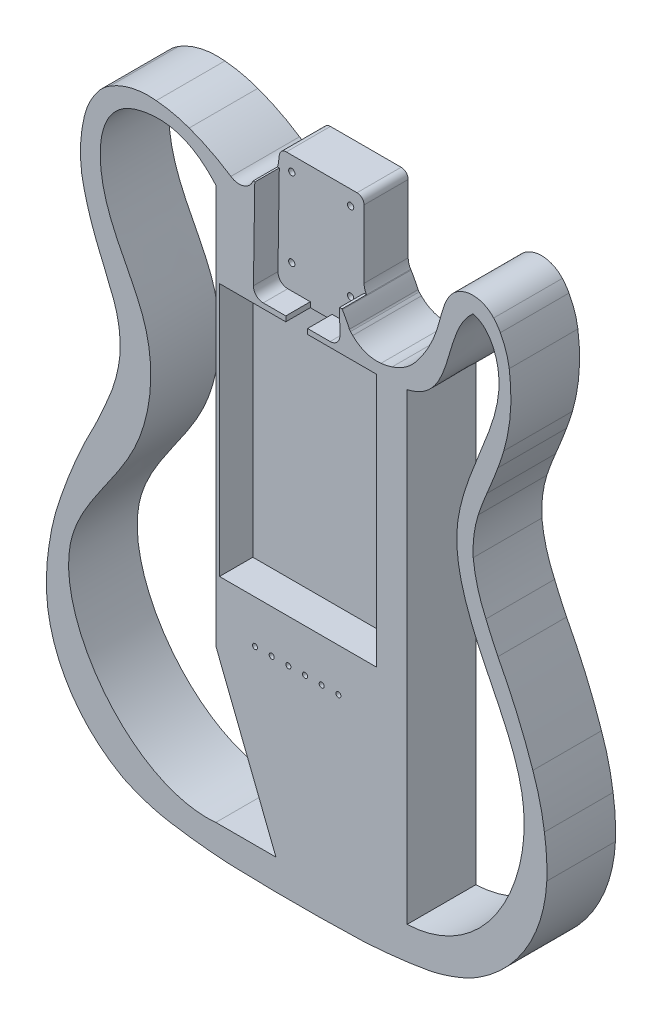
from build123d import *

# Parameters (mm, degrees)
EXTRUDE1_DEPTH     = 44.45
EXTRUDE2_START     = -15.875
EXTRUDE2_DEPTH     = 15.875
SKETCH4_R          = 2.032
EXTRUDE3_DEPTH     = 661.142024979
SKETCH5_W          = 14.1224
SKETCH5_H          = 11.557
EXTRUDE4_DEPTH     = 15.875
EXTRUDE5_DEPTH     = 17.4498
EXTRUDE6_DEPTH     = 21.59
EXTRUDE9_DEPTH     = 17.4498
SKETCH12_R         = 1.651
EXTRUDE10_DEPTH    = 662.019489136
SKETCH13_R         = 4.826
EXTRUDE11_DEPTH    = 1.4224
SKETCH14_R         = 4.064
EXTRUDE12_DEPTH    = 7.874
CUT_EXTRUDE1_REACH = 663.019
SKETCH15_W         = 101.6
SKETCH15_H         = 164.234062165
CUT_EXTRUDE2_DEPTH = 127
CUT_EXTRUDE3_DEPTH = 127
CUT_EXTRUDE4_DEPTH = 76.2


with BuildPart() as part:
    # Sketch2 → Extrude1 (new body)
    with BuildSketch(Plane.XY):
        with BuildLine():
            Line((236.701314765, -109.52926958), (237.322551245, -104.518285004))
            ThreePointArc((237.322551245, -104.518285004), (238.832324595, -101.654790046), (241.859816, -100.5087906))
            Line((241.859816, -100.5087906), (287.627187, -100.5087906))
            ThreePointArc((287.627187, -100.5087906), (290.860079204, -101.847898396), (292.199187, -105.0807906))
            Line((292.199187, -105.0807906), (292.199187, -149.0184218))
            ThreePointArc((292.199187, -149.0184218), (292.597958053, -151.927621282), (293.795193618, -154.608868562))
            ThreePointArc((293.795193618, -154.608868562), (293.913773723, -154.790051229), (294.036001367, -154.968793512))
            ThreePointArc((294.036001367, -154.968793512), (296.462850079, -159.222895043), (298.58610753, -163.636368995))
            ThreePointArc((298.58610753, -163.636368995), (298.881112709, -164.165143005), (299.271135507, -164.628297651))
            ThreePointArc((299.271135507, -164.628297651), (300.007264707, -165.356749106), (300.73644663, -166.092154739))
            ThreePointArc((300.73644663, -166.092154739), (309.134939866, -171.428010927), (319.025875401, -172.512189948))
            ThreePointArc((319.025875401, -172.512189948), (322.667874381, -171.899747758), (326.235195219, -170.94399463))
            ThreePointArc((326.235195219, -170.94399463), (334.736991182, -166.788776714), (341.69241097, -160.372507853))
            ThreePointArc((341.69241097, -160.372507853), (350.978860141, -145.938116384), (356.931481894, -129.839790708))
            ThreePointArc((356.931481894, -129.839790708), (358.444492908, -124.360678247), (360.217684146, -118.960153409))
            ThreePointArc((360.217684146, -118.960153409), (361.726955491, -115.496522091), (363.691265694, -112.269119525))
            ThreePointArc((363.691265694, -112.269119525), (377.452236791, -104.634981944), (392.000789341, -110.63364853))
            ThreePointArc((392.000789341, -110.63364853), (394.334174265, -113.548333419), (396.320318679, -116.709868421))
            ThreePointArc((396.320318679, -116.709868421), (399.985801408, -125.076496738), (402.069054575, -133.970106202))
            ThreePointArc((402.069054575, -133.970106202), (402.850473596, -158.142444635), (398.510836922, -181.934882814))
            ThreePointArc((398.510836922, -181.934882814), (396.712752953, -187.660630305), (394.711731045, -193.318651304))
            ThreePointArc((394.711731045, -193.318651304), (391.254221541, -202.284530505), (387.604313736, -211.173823775))
            ThreePointArc((387.604313736, -211.173823775), (384.645418623, -218.559200445), (381.97307243, -226.053025547))
            ThreePointArc((381.97307243, -226.053025547), (379.220115758, -238.701804496), (378.745605361, -251.638002516))
            ThreePointArc((378.745605361, -251.638002516), (381.624241727, -267.094911335), (387.005590994, -281.867983379))
            ThreePointArc((387.005590994, -281.867983379), (390.741696955, -290.562895178), (394.746018404, -299.137589848))
            ThreePointArc((394.746018404, -299.137589848), (407.105387056, -324.908404556), (417.355590006, -351.588401252))
            ThreePointArc((417.355590006, -351.588401252), (421.906718125, -366.822834456), (424.846419648, -382.448418515))
            ThreePointArc((424.846419648, -382.448418515), (426.249850723, -395.79034395), (426.367663828, -409.205362144))
            ThreePointArc((426.367663828, -409.205362144), (413.851256788, -452.11341389), (383.140740026, -484.58841212))
            ThreePointArc((383.140740026, -484.58841212), (376.726903694, -488.327090669), (369.979691238, -491.423885444))
            ThreePointArc((369.979691238, -491.423885444), (361.755548517, -494.399048058), (353.346112162, -496.801025635))
            ThreePointArc((353.346112162, -496.801025635), (351.598275163, -497.203126282), (349.837333504, -497.543278577))
            ThreePointArc((349.837333504, -497.543278577), (328.927692137, -500.563756073), (307.875617353, -502.337603226))
            ThreePointArc((307.875617353, -502.337603226), (264.647049723, -503.080365686), (221.41824861, -502.351318606))
            ThreePointArc((221.41824861, -502.351318606), (221.00580821, -502.335100706), (220.593567708, -502.314415619))
            ThreePointArc((220.593567708, -502.314415619), (201.284363819, -500.712124888), (182.091052494, -498.06080619))
            ThreePointArc((182.091052494, -498.06080619), (175.416754512, -496.721648206), (168.847112314, -494.938561263))
            ThreePointArc((168.847112314, -494.938561263), (162.119330737, -492.66041844), (155.529409804, -490.009772905))
            ThreePointArc((155.529409804, -490.009772905), (153.132812394, -488.891967619), (150.797631292, -487.650961163))
            ThreePointArc((150.797631292, -487.650961163), (116.491995751, -454.558228352), (102.514776867, -408.988030339))
            ThreePointArc((102.514776867, -408.988030339), (102.647448667, -395.681700976), (104.046018753, -382.448409448))
            ThreePointArc((104.046018753, -382.448409448), (106.98510575, -366.822864688), (111.535598588, -351.588400588))
            ThreePointArc((111.535598588, -351.588400588), (121.785921274, -324.908172846), (134.146411655, -299.137609307))
            ThreePointArc((134.146411655, -299.137609307), (138.150111982, -290.562902597), (141.885599861, -281.867999389))
            ThreePointArc((141.885599861, -281.867999389), (147.267652973, -267.095112393), (150.145582523, -251.638003757))
            ThreePointArc((150.145582523, -251.638003757), (148.821670426, -233.475790137), (143.036402463, -216.208786303))
            ThreePointArc((143.036402463, -216.208786303), (140.009349985, -208.5521602), (136.805998568, -200.967602883))
            ThreePointArc((136.805998568, -200.967602883), (133.075014503, -191.465363775), (129.82521382, -181.787988837))
            ThreePointArc((129.82521382, -181.787988837), (127.242537041, -172.460798588), (125.255618654, -162.988794966))
            ThreePointArc((125.255618654, -162.988794966), (124.573431659, -146.269657735), (127.035980496, -129.718803313))
            ThreePointArc((127.035980496, -129.718803313), (131.043720455, -119.123881134), (137.44559748, -109.77881152))
            ThreePointArc((137.44559748, -109.77881152), (140.408836969, -107.058482812), (143.665986338, -104.697984023))
            ThreePointArc((143.665986338, -104.697984023), (158.033642326, -98.861944673), (173.515606109, -97.968809036))
            ThreePointArc((173.515606109, -97.968809036), (184.337065562, -99.609972723), (194.84638863, -102.668000127))
            ThreePointArc((194.84638863, -102.668000127), (208.754429598, -108.681110615), (221.847962027, -116.306758775))
            ThreePointArc((221.847962027, -116.306758775), (231.168773326, -117.069146469), (236.701314765, -109.52926958))
        make_face()
    extrude(amount=EXTRUDE1_DEPTH)

    # Sketch3 → Extrude2 (cut)
    with BuildSketch(Plane.XY.offset(44.45).offset(EXTRUDE2_START)):
        with BuildLine():
            Line((292.208331, -154.6088094), (293.795193618, -154.608868562))
            ThreePointArc((293.795193618, -154.608868562), (292.597958053, -151.927621282), (292.199187, -149.0184218))
            Line((292.199187, -149.0184218), (292.199187, -105.0807906))
            ThreePointArc((292.199187, -105.0807906), (290.860079204, -101.847898396), (287.627187, -100.5087906))
            Line((287.627187, -100.5087906), (241.859816, -100.5087906))
            ThreePointArc((241.859816, -100.5087906), (238.832324595, -101.654790046), (237.322551245, -104.518285004))
            Line((237.322551245, -104.518285004), (236.701314765, -109.52926958))
            ThreePointArc((236.701314765, -109.52926958), (236.495331634, -110.644913986), (236.1589638, -111.7284024))
            Line((236.1589638, -111.7284024), (237.3235792, -111.7284024))
            Line((237.3235792, -111.7284024), (236.4498446, -170.3148994))
            ThreePointArc((236.4498446, -170.3148994), (238.275654169, -174.866112687), (242.7991334, -176.7595906))
            Line((242.7991334, -176.7595906), (257.3850072, -176.7595906))
            Line((257.3850072, -176.7595906), (271.5074072, -176.7595906))
            Line((271.5074072, -176.7595906), (286.0932556, -176.7595906))
            ThreePointArc((286.0932556, -176.7595906), (290.616738468, -174.866114216), (292.44254953, -170.31489855))
            Line((292.44254953, -170.31489855), (292.208331, -154.6088094))
        make_face()
    extrude(amount=EXTRUDE2_DEPTH, mode=Mode.SUBTRACT)

    # Sketch4 → Extrude3 (cut, through all)
    with BuildSketch(Plane.XY.offset(28.575)):
        with Locations((283.497782, -160.8336128)):
            Circle(SKETCH4_R)
        with Locations((245.397782, -160.8336128)):
            Circle(SKETCH4_R)
        with Locations((245.397782, -110.0336128)):
            Circle(SKETCH4_R)
        with Locations((283.497782, -110.0336128)):
            Circle(SKETCH4_R)
    extrude(amount=-EXTRUDE3_DEPTH, mode=Mode.SUBTRACT)

    # Sketch5 → Extrude4 (cut)
    with BuildSketch(Plane.XY.offset(44.45)):
        with Locations((264.4462072, -182.5380906)):
            Rectangle(SKETCH5_W, SKETCH5_H)
    extrude(amount=-EXTRUDE4_DEPTH, mode=Mode.SUBTRACT)

    # Sketch6 → Extrude5 (cut)
    with BuildSketch(Plane.XY.offset(44.45)):
        with BuildLine():
            Line((271.5074072, -188.3165906), (257.3850072, -188.3165906))
            Line((257.3850072, -188.3165906), (231.3870912, -188.3165906))
            ThreePointArc((231.3870912, -188.3165906), (223.137023148, -195.487932604), (229.089965361, -204.656042988))
            Line((229.089965361, -204.656042988), (254.492106786, -211.942516007))
            ThreePointArc((254.492106786, -211.942516007), (254.925516864, -212.034671401), (255.367536, -212.0655906))
            Line((255.367536, -212.0655906), (264.4462072, -212.0655906))
            Line((264.4462072, -212.0655906), (273.5248276, -212.0655906))
            ThreePointArc((273.5248276, -212.0655906), (273.966846297, -212.034671463), (274.400255962, -211.942516252))
            Line((274.400255962, -211.942516252), (299.802422661, -204.656043269))
            ThreePointArc((299.802422661, -204.656043269), (305.755365923, -195.487933108), (297.5052978, -188.3165906))
            Line((297.5052978, -188.3165906), (271.5074072, -188.3165906))
        make_face()
    extrude(amount=-EXTRUDE5_DEPTH, mode=Mode.SUBTRACT)

    # Sketch7 → Extrude6 (cut)
    with BuildSketch(Plane.XY.offset(44.45)):
        with BuildLine():
            Line((267.182014608, -293.873950251), (237.365174798, -296.644421471))
            ThreePointArc((237.365174798, -296.644421471), (229.219374538, -301.565359429), (228.0253758, -311.0069726))
            Line((228.0253758, -311.0069726), (233.0908216, -326.0407246))
            ThreePointArc((233.0908216, -326.0407246), (234.905674363, -328.839037735), (237.841094697, -330.422563679))
            Line((237.841094697, -330.422563679), (280.248995, -340.9960414))
            ThreePointArc((280.248995, -340.9960414), (283.58425184, -340.975976581), (286.500413487, -339.357229523))
            Line((286.500413487, -339.357229523), (298.0308492, -328.4612938))
            ThreePointArc((298.0308492, -328.4612938), (301.409166684, -319.564297135), (296.527090326, -311.395153414))
            Line((296.527090326, -311.395153414), (271.5010572, -294.9508198))
            ThreePointArc((271.5010572, -294.9508198), (269.433129751, -294.04502602), (267.182014608, -293.873950251))
        make_face()
    extrude(amount=-EXTRUDE6_DEPTH, mode=Mode.SUBTRACT)

    # Sketch11 → Extrude9 (cut)
    with BuildSketch(Plane.XY.offset(44.45)):
        with BuildLine():
            Line((311.5027552, -266.3978924), (268.936335809, -223.831463088))
            ThreePointArc((268.936335809, -223.831463088), (259.956079688, -223.831461991), (259.956078591, -232.811718112))
            Line((259.956078591, -232.811718112), (302.5224836, -275.3781386))
            ThreePointArc((302.5224836, -275.3781386), (307.012620383, -277.238017465), (311.502756589, -275.378137211))
            ThreePointArc((311.502756589, -275.378137211), (313.362621365, -270.888014517), (311.5027552, -266.3978924))
        make_face()
    extrude(amount=-EXTRUDE9_DEPTH, mode=Mode.SUBTRACT)

    # Sketch12 → Extrude10 (cut, through all)
    with BuildSketch(Plane.XY.offset(44.45)):
        with Locations((291.446204, -372.0851842)):
            Circle(SKETCH12_R)
        with Locations((280.6516104, -372.0851842)):
            Circle(SKETCH12_R)
        with Locations((269.8566104, -372.0851842)):
            Circle(SKETCH12_R)
        with Locations((259.0610008, -372.0851842)):
            Circle(SKETCH12_R)
        with Locations((248.2654166, -372.0851842)):
            Circle(SKETCH12_R)
        with Locations((237.4713818, -372.0851842)):
            Circle(SKETCH12_R)
    extrude(amount=-EXTRUDE10_DEPTH, mode=Mode.SUBTRACT)

    # Sketch13 → Extrude11 (cut)
    with BuildSketch(Plane(origin=(0, 0, 0), x_dir=(-1, 0, 0), z_dir=(0, 0, -1))):
        with Locations((-291.446204, -372.0851842)):
            Circle(SKETCH13_R)
        with Locations((-280.6516104, -372.0851842)):
            Circle(SKETCH13_R)
        with Locations((-269.8566104, -372.0851842)):
            Circle(SKETCH13_R)
        with Locations((-259.0610008, -372.0851842)):
            Circle(SKETCH13_R)
        with Locations((-248.2654166, -372.0851842)):
            Circle(SKETCH13_R)
        with Locations((-237.4713818, -372.0851842)):
            Circle(SKETCH13_R)
    extrude(amount=-EXTRUDE11_DEPTH, mode=Mode.SUBTRACT)

    # Sketch14 → Extrude12 (cut)
    with BuildSketch(Plane(origin=(0, 0, 0), x_dir=(-1, 0, 0), z_dir=(0, 0, -1))):
        with Locations((-291.446204, -372.0851842)):
            Circle(SKETCH14_R)
        with Locations((-280.6516104, -372.0851842)):
            Circle(SKETCH14_R)
        with Locations((-269.8566104, -372.0851842)):
            Circle(SKETCH14_R)
        with Locations((-259.0610008, -372.0851842)):
            Circle(SKETCH14_R)
        with Locations((-248.2654166, -372.0851842)):
            Circle(SKETCH14_R)
        with Locations((-237.4713818, -372.0851842)):
            Circle(SKETCH14_R)
    extrude(amount=-EXTRUDE12_DEPTH, mode=Mode.SUBTRACT)

    # Cut-Extrude1: up to this face of the body (flat: up to its plane)
    cut_extrude1_end = Plane(part.part.faces().sort_by_distance((263.793748235, -316.663316897, 22.86))[0])
    # Sketch15 → Cut-Extrude1 (cut, up to the picked face)
    with BuildSketch(Plane.XY.offset(44.45), mode=Mode.PRIVATE) as cut_extrude1_sk1:
        with Locations((265.2843056, -262.20414602)):
            Rectangle(SKETCH15_W, SKETCH15_H)
    cut_extrude1_tool1 = split(extrude(cut_extrude1_sk1.sketch, amount=-CUT_EXTRUDE1_REACH, mode=Mode.PRIVATE), bisect_by=cut_extrude1_end, keep=Keep.BOTH, mode=Mode.PRIVATE)
    add(cut_extrude1_tool1.solids().sort_by(Axis((265.284306, -262.204146, 44.45), (0, 0, -1)))[0], mode=Mode.SUBTRACT)

    # Sketch16 → Cut-Extrude2 (cut)
    with BuildSketch(Plane.XY.offset(44.45)):
        with BuildLine():
            Line((212.117694336, -126.053047777), (212.117694336, -483.398916887))
            add(Edge.make_bspline(
                [(159.770735068, -109.697476494), (135.695847539, -117.22364313), (132.536634655, -173.144528027), (175.573898591, -226.464399234), (166.83717468, -308.244385142), (79.954647743, -386.36584678), (159.442258277, -488.515057032), (212.117694336, -483.398916887)],
                knots=[0, 0, 0, 0, 0.149042994, 0.296708805, 0.45565069, 0.647251254, 1, 1, 1, 1], degree=3))
            add(Edge.make_bspline(
                [(159.770735068, -109.697476494), (189.910349197, -100.671756931), (212.117694336, -126.053047777)],
                knots=[0, 0, 0, 1, 1, 1], degree=2))
        make_face()
    extrude(amount=-CUT_EXTRUDE2_DEPTH, mode=Mode.SUBTRACT)

    # Sketch17 → Cut-Extrude3 (cut)
    with BuildSketch(Plane.XY.offset(44.45)):
        with BuildLine():
            Line((335.944612713, -178.791328569), (335.944612713, -478.667928848))
            add(Edge.make_bspline(
                [(378.597163477, -114.993083373), (386.103981492, -116.715709585), (401.941599585, -140.982772003), (384.733180917, -188.652966028), (361.840879188, -239.796113348), (381.022273443, -305.986134394), (435.316188683, -384.078546004), (386.634558396, -476.346923246), (335.944612713, -478.667928848)],
                knots=[0, 0, 0, 0, 0.053147341, 0.186283845, 0.336552989, 0.449657579, 0.663660518, 1, 1, 1, 1], degree=3))
            add(Edge.make_bspline(
                [(378.597163477, -114.993083373), (357.974783018, -133.1978322), (367.973021641, -171.509733696), (335.944612713, -178.791328569)],
                knots=[0, 0, 0, 0, 1, 1, 1, 1], degree=3))
        make_face()
    extrude(amount=-CUT_EXTRUDE3_DEPTH, mode=Mode.SUBTRACT)

    # Sketch18 → Cut-Extrude4 (cut)
    with BuildSketch(Plane.XY.offset(44.45)):
        Polygon((212.117694336, -384.507041431), (251.034099106, -483.398916887), (212.117694336, -483.398916887), align=None)
    extrude(amount=-CUT_EXTRUDE4_DEPTH, mode=Mode.SUBTRACT)


solid = part.part
